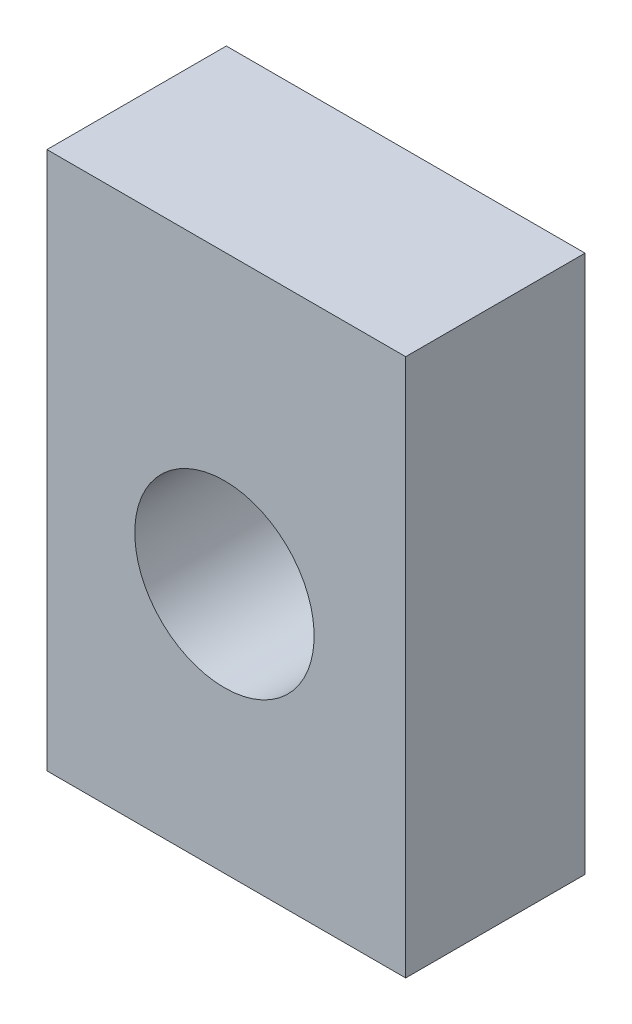
from build123d import *

# Parameters (mm, degrees)
SKETCH1_W           = 6.35
SKETCH1_H           = 19.05
BOSS_EXTRUDE1_DEPTH = 12.7
SKETCH2_R           = 3.175
CUT_EXTRUDE1_DEPTH  = 12.7


with BuildPart() as part:
    # Sketch1 → Boss-Extrude1 (new body)
    with BuildSketch(Plane(origin=(0, 0, 0), x_dir=(0, 0, -1), z_dir=(1, 0, 0))):
        Rectangle(SKETCH1_W, SKETCH1_H)
    extrude(amount=BOSS_EXTRUDE1_DEPTH)

    # Sketch2 → Cut-Extrude1 (cut)
    with BuildSketch(Plane(origin=(0, 0, -3.175), x_dir=(-1, 0, 0), z_dir=(0, 0, -1))):
        with Locations(Location((-6.284055676, -0.659443238, 0), (0, 0, 90))):
            Circle(SKETCH2_R)
    extrude(amount=-CUT_EXTRUDE1_DEPTH, mode=Mode.SUBTRACT)


solid = part.part
